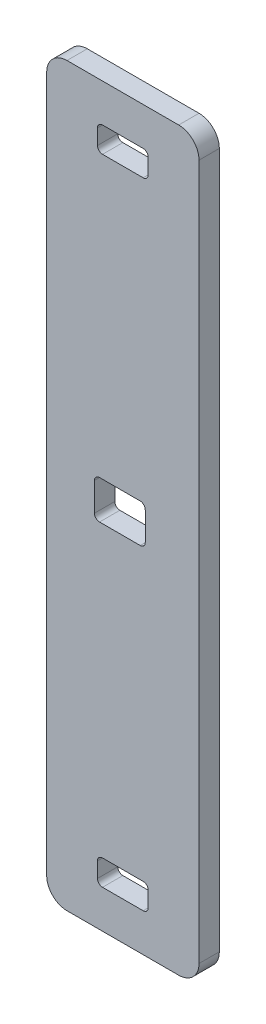
from build123d import *

# Parameters (mm, degrees)
BOSS_EXTRU_1_DEPTH      = 4
ENL_V_MAT_EXTRU_1_DEPTH = 75.143442057


with BuildPart() as part:
    # Esquisse1 → Boss.-Extru.1 (new body)
    with BuildSketch(Plane.XY):
        with BuildLine():
            Line((-11, -72.5), (11, -72.5))
            ThreePointArc((11, -72.5), (13.828427125, -71.328427125), (15, -68.5))
            Line((15, -68.5), (15, 68.5))
            ThreePointArc((15, 68.5), (13.828427125, 71.328427125), (11, 72.5))
            Line((11, 72.5), (-11, 72.5))
            ThreePointArc((-11, 72.5), (-13.828427125, 71.328427125), (-15, 68.5))
            Line((-15, 68.5), (-15, -68.5))
            ThreePointArc((-15, -68.5), (-13.828427125, -71.328427125), (-11, -72.5))
        make_face()
    extrude(amount=BOSS_EXTRU_1_DEPTH)

    # Esquisse2 → Enlèv. mat.-Extru.1 (cut, through all)
    with BuildSketch(Plane.XY.offset(4)):
        with BuildLine():
            Line((-4, -60), (4, -60))
            ThreePointArc((4, -60), (4.707106781, -60.292893219), (5, -61))
            Line((5, -61), (5, -64))
            ThreePointArc((5, -64), (4.707106781, -64.707106781), (4, -65))
            Line((4, -65), (-4, -65))
            ThreePointArc((-4, -65), (-4.707106781, -64.707106781), (-5, -64))
            Line((-5, -64), (-5, -61))
            ThreePointArc((-5, -61), (-4.707106781, -60.292893219), (-4, -60))
        make_face()
        with BuildLine():
            Line((-4, 65), (4, 65))
            ThreePointArc((4, 65), (4.707106781, 64.707106781), (5, 64))
            Line((5, 64), (5, 61))
            ThreePointArc((5, 61), (4.707106781, 60.292893219), (4, 60))
            Line((4, 60), (-4, 60))
            ThreePointArc((-4, 60), (-4.707106781, 60.292893219), (-5, 61))
            Line((-5, 61), (-5, 64))
            ThreePointArc((-5, 64), (-4.707106781, 64.707106781), (-4, 65))
        make_face()
        with BuildLine():
            Line((-4.587622439, 4.585), (3.412377561, 4.585))
            ThreePointArc((3.412377561, 4.585), (4.119484342, 4.292106781), (4.412377561, 3.585))
            Line((4.412377561, 3.585), (4.412377561, -2))
            ThreePointArc((4.412377561, -2), (4.119484342, -2.707106781), (3.412377561, -3))
            Line((3.412377561, -3), (-4.587622439, -3))
            ThreePointArc((-4.587622439, -3), (-5.29472922, -2.707106781), (-5.587622439, -2))
            Line((-5.587622439, -2), (-5.587622439, 3.585))
            ThreePointArc((-5.587622439, 3.585), (-5.29472922, 4.292106781), (-4.587622439, 4.585))
        make_face()
    extrude(amount=-ENL_V_MAT_EXTRU_1_DEPTH, mode=Mode.SUBTRACT)


solid = part.part
